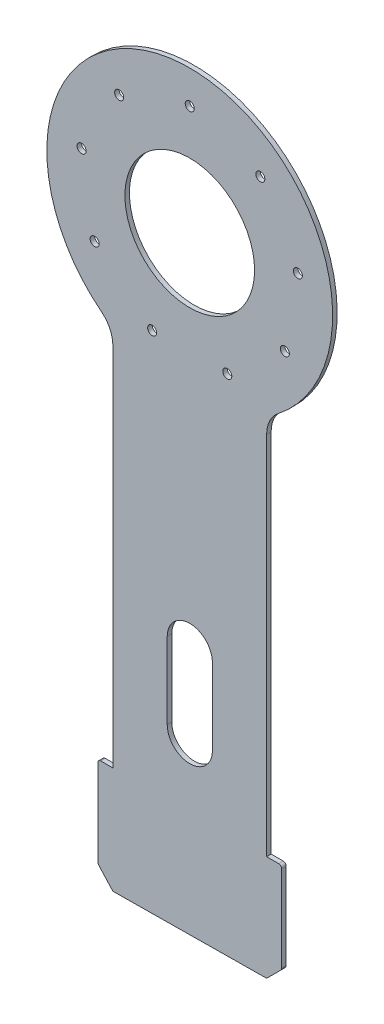
from build123d import *

# Parameters (mm, degrees)
SKETCH1_R             = 47.5
SKETCH1_R_2           = 21.55
BOSS_EXTRUDE1_DEPTH   = 1.5
F_3_0MM_DOWEL_HOLE1_D = 3
CIRPATTERN1_COUNT     = 9
BOSS_EXTRUDE2_DEPTH   = 1.5
FILLET7_R             = 10
FILLET8_R             = 10
FILLET9_R             = 1
FILLET10_R            = 1
CUT_EXTRUDE2_DEPTH    = 1.5


with BuildPart() as part:
    # Sketch1 → Boss-Extrude1 (new body)
    with BuildSketch(Plane.XY):
        Circle(SKETCH1_R)
        Circle(SKETCH1_R_2, mode=Mode.SUBTRACT)
    extrude(amount=BOSS_EXTRUDE1_DEPTH)

    # Ø3.0mm Dowel Hole1 (through all)
    with Locations(Plane.XY.offset(1.5)):
        with Locations((0, 36.5)):
            f_3_0mm_dowel_hole1 = Hole(F_3_0MM_DOWEL_HOLE1_D / 2)

    # CirPattern1: Ø3.0mm Dowel Hole1 ×9 about axis
    cirpattern1_axis = Axis((0, 0, 0), (0, 0, 1))
    for i in range(1, CIRPATTERN1_COUNT):
        add(f_3_0mm_dowel_hole1.rotate(cirpattern1_axis, i * 360 / CIRPATTERN1_COUNT), mode=Mode.SUBTRACT)

    # Sketch6 → Boss-Extrude2 (add)
    with BuildSketch(Plane.XY.offset(1.5)):
        Polygon((-25.563438214, -40.034492962), (25.563438214, -40.034492962), (25.563438214, -166.774492962), (30.563438214, -166.774492962), (30.563438214, -196.784492962), (25.563438214, -201.784492962), (-25.563438214, -202.2867607), (-30.563438214, -196.784492962), (-30.563438214, -166.784492962), (-25.563438214, -166.784492962), align=None)
    extrude(amount=-BOSS_EXTRUDE2_DEPTH)

    # Fillet7
    fillet7_edges = [part.edges().sort_by_distance(p)[0] for p in [
        (-25.563438214, -40.034492962, 0.75),
    ]]
    fillet(fillet7_edges, radius=FILLET7_R)

    # Fillet8
    fillet8_edges = [part.edges().sort_by_distance(p)[0] for p in [
        (25.563438214, -40.034492962, 0.75),
    ]]
    fillet(fillet8_edges, radius=FILLET8_R)

    # Fillet9
    fillet9_edges = [part.edges().sort_by_distance(p)[0] for p in [
        (30.563438214, -166.774492962, 0.75),
        (-30.563438214, -166.784492962, 0.75),
    ]]
    fillet(fillet9_edges, radius=FILLET9_R)

    # Fillet10
    fillet10_edges = [part.edges().sort_by_distance(p)[0] for p in [
        (30.563438214, -196.784492962, 0.75),
        (25.563438214, -201.784492962, 0.75),
        (-25.563438214, -202.2867607, 0.75),
        (-30.563438214, -196.784492962, 0.75),
    ]]
    fillet(fillet10_edges, radius=FILLET10_R)

    # Sketch8 → Cut-Extrude2 (cut)
    with BuildSketch(Plane(origin=(0, 0, 0), x_dir=(-1, 0, 0), z_dir=(0, 0, -1))):
        with BuildLine():
            Line((-7.519953185, -145.285430812), (-7.519953185, -119.885430812))
            ThreePointArc((-7.519953185, -119.885430812), (-0.019953185, -112.385430812), (7.480046815, -119.885430812))
            Line((7.480046815, -119.885430812), (7.480046815, -145.285430812))
            ThreePointArc((7.480046815, -145.285430812), (-0.019953185, -152.785430812), (-7.519953185, -145.285430812))
        make_face()
    extrude(amount=-CUT_EXTRUDE2_DEPTH, mode=Mode.SUBTRACT)


solid = part.part
